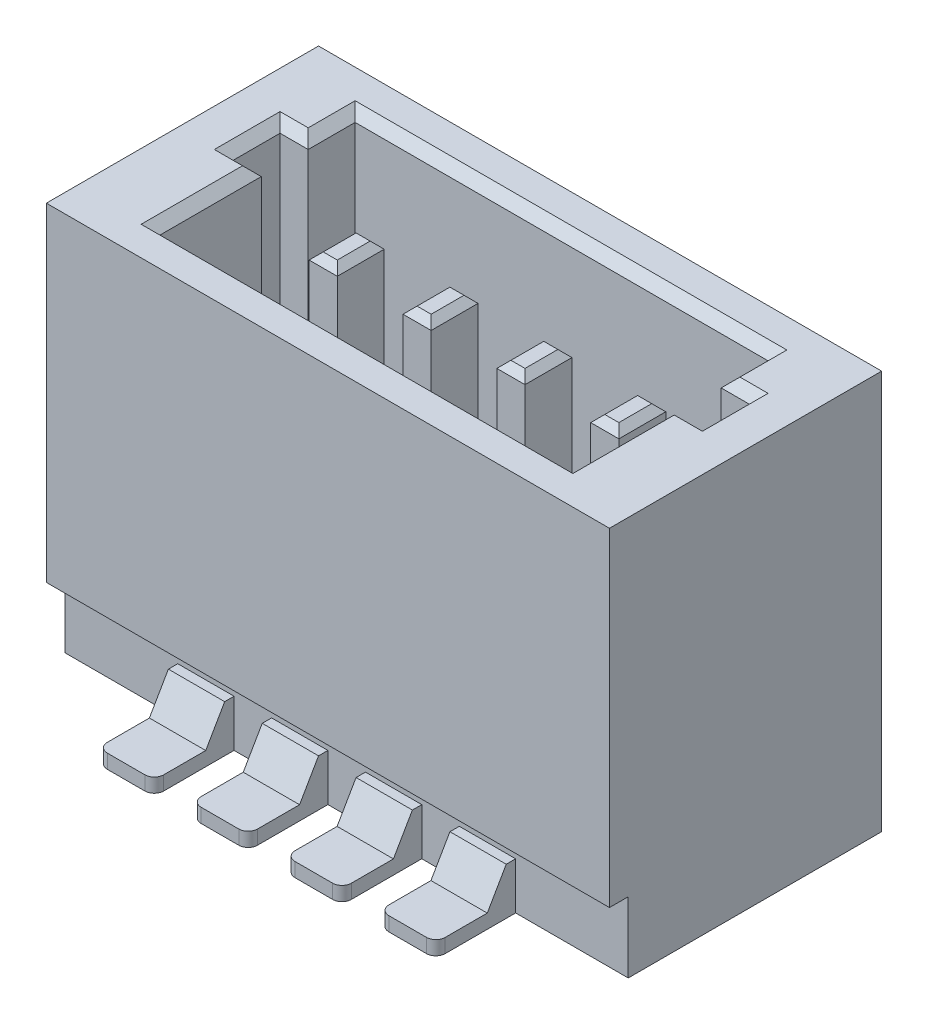
from build123d import *

# Parameters (mm, degrees)
SKETCH1_W           = 6
SKETCH1_H           = 2.9
BOSS_EXTRUDE1_DEPTH = 4.25
CUT_EXTRUDE1_DEPTH  = 3.2
SKETCH4_W           = 6
SKETCH4_H           = 0.75
CUT_EXTRUDE2_DEPTH  = 0.2
SKETCH5_W           = 0.6
SKETCH5_H           = 0.5
BOSS_EXTRUDE2_DEPTH = 0.85
CUT_EXTRUDE3_DEPTH  = 7.74629528
SKETCH7_W           = 0.3
SKETCH7_H           = 0.5
BOSS_EXTRUDE3_DEPTH = 2.7
CHAMFER1_SIZE       = 0.075
FILLET1_R           = 0.1
CHAMFER2_SIZE       = 0.1


with BuildPart() as part:
    # Sketch1 → Boss-Extrude1 (new body)
    with BuildSketch(Plane(origin=(0, 0, 0), x_dir=(1, 0, 0), z_dir=(0, 1, 0))):
        Rectangle(SKETCH1_W, SKETCH1_H)
    extrude(amount=BOSS_EXTRUDE1_DEPTH)

    # Sketch2 → Cut-Extrude1 (cut)
    with BuildSketch(Plane(origin=(0, 4.25, 0), x_dir=(1, 0, 0), z_dir=(0, 1, 0))):
        Polygon((2.2, 0.04), (2.5, 0.04), (2.5, 0.54), (2.2, 0.54), (2.2, 1.04), (-2.2, 1.04), (-2.2, 0.54), (-2.5, 0.54), (-2.5, 0.04), (-2.2, 0.04), (-2.2, -1.04), (2.2, -1.04), align=None)
    extrude(amount=-CUT_EXTRUDE1_DEPTH, mode=Mode.SUBTRACT)

    # Sketch4 → Cut-Extrude2 (cut)
    with BuildSketch(Plane.XY.offset(1.45)):
        with Locations((0, 0.375)):
            Rectangle(SKETCH4_W, SKETCH4_H)
    extrude(amount=-CUT_EXTRUDE2_DEPTH, mode=Mode.SUBTRACT)

    # Sketch5 → Boss-Extrude2 (add)
    with BuildSketch(Plane.XY.offset(1.25)):
        with Locations((-0.5, 0.25)):
            Rectangle(SKETCH5_W, SKETCH5_H)
        with Locations((-1.5, 0.25)):
            Rectangle(SKETCH5_W, SKETCH5_H)
        with Locations((1.5, 0.25)):
            Rectangle(SKETCH5_W, SKETCH5_H)
        with Locations((0.5, 0.25)):
            Rectangle(SKETCH5_W, SKETCH5_H)
    extrude(amount=BOSS_EXTRUDE2_DEPTH)

    # Sketch6 → Cut-Extrude3 (cut, through all)
    with BuildSketch(Plane(origin=(1.8, 0, 0), x_dir=(0, 0, -1), z_dir=(1, 0, 0))):
        Polygon((-1.35, 0.5), (-1.552072594, 0.15), (-2.1, 0.15), (-2.1, 0.5), align=None)
    extrude(amount=-CUT_EXTRUDE3_DEPTH, mode=Mode.SUBTRACT)

    # Sketch7 → Boss-Extrude3 (add)
    with BuildSketch(Plane(origin=(0, 1.05, 0), x_dir=(1, 0, 0), z_dir=(0, 1, 0))):
        with Locations((-1.5, 0.25)):
            Rectangle(SKETCH7_W, SKETCH7_H)
        with Locations((-0.5, 0.25)):
            Rectangle(SKETCH7_W, SKETCH7_H)
        with Locations((1.5, 0.25)):
            Rectangle(SKETCH7_W, SKETCH7_H)
        with Locations((0.5, 0.25)):
            Rectangle(SKETCH7_W, SKETCH7_H)
    extrude(amount=BOSS_EXTRUDE3_DEPTH)

    # Chamfer1
    chamfer1_edges = [part.edges().sort_by_distance(p)[0] for p in [
        (-0.5, 3.75, 0),
        (-0.65, 3.75, -0.25),
        (-0.5, 3.75, -0.5),
        (-0.35, 3.75, -0.25),
        (-1.5, 3.75, 0),
        (-1.65, 3.75, -0.25),
        (-1.5, 3.75, -0.5),
        (-1.35, 3.75, -0.25),
        (1.5, 3.75, -0.5),
        (1.65, 3.75, -0.25),
        (1.5, 3.75, 0),
        (1.35, 3.75, -0.25),
        (0.35, 3.75, -0.25),
        (0.5, 3.75, -0.5),
        (0.65, 3.75, -0.25),
        (0.5, 3.75, 0),
    ]]
    chamfer(chamfer1_edges, length=CHAMFER1_SIZE)

    # Fillet1
    fillet1_edges = [part.edges().sort_by_distance(p)[0] for p in [
        (0.2, 0.075, 2.1),
        (1.2, 0.075, 2.1),
        (-1.8, 0.075, 2.1),
        (-0.8, 0.075, 2.1),
        (-0.2, 0.075, 2.1),
        (-1.2, 0.075, 2.1),
        (1.8, 0.075, 2.1),
        (0.8, 0.075, 2.1),
    ]]
    fillet(fillet1_edges, radius=FILLET1_R)

    # Chamfer2
    chamfer2_edges = [part.edges().sort_by_distance(p)[0] for p in [
        (2.2, 4.25, -0.79),
        (0, 4.25, -1.04),
        (-2.2, 4.25, -0.79),
        (-2.35, 4.25, -0.54),
        (-2.5, 4.25, -0.29),
        (-2.35, 4.25, -0.04),
        (-2.2, 4.25, 0.5),
        (0, 4.25, 1.04),
        (2.2, 4.25, 0.5),
        (2.35, 4.25, -0.04),
        (2.5, 4.25, -0.29),
        (2.35, 4.25, -0.54),
    ]]
    chamfer(chamfer2_edges, length=CHAMFER2_SIZE)


solid = part.part
